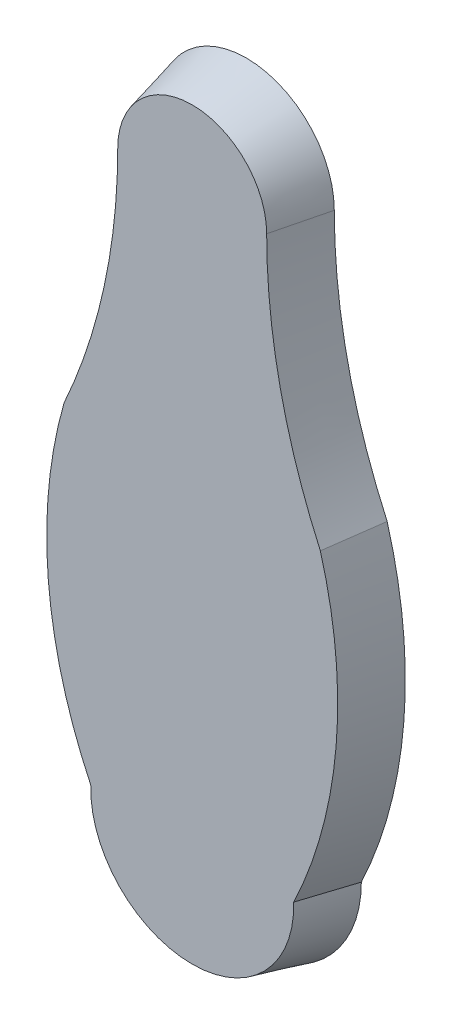
from build123d import *

# Parameters (mm, degrees)
BOSS_EXTRUDE1_DEPTH = 20
BOSS_EXTRUDE1_DRAFT = 14


with BuildPart() as part:
    # Sketch1 → Boss-Extrude1 (with draft: the straight prism first)
    with BuildSketch(Plane.XY):
        with BuildLine():
            ThreePointArc((-42.5, 0), (0, -42.5), (42.5, 0))
            ThreePointArc((42.5, 0), (58.212978051, 59.230104498), (52.040453066, 120.197332527))
            ThreePointArc((52.040453066, 120.197332527), (37.441607235, 164.047991362), (32.5, 210))
            ThreePointArc((32.5, 210), (0, 242.5), (-32.5, 210))
            ThreePointArc((-32.5, 210), (-37.441607235, 164.047991362), (-52.040453066, 120.197332527))
            ThreePointArc((-52.040453066, 120.197332527), (-58.212978051, 59.230104498), (-42.5, 0))
        make_face()
    extrude(amount=BOSS_EXTRUDE1_DEPTH)
    # Boss-Extrude1: the draft: its side faces are tilted about the plane it starts from
    boss_extrude1_sides = [part.faces().sort_by_distance(p)[0] for p in [
        (-58.212978051, 59.230104498, 10),
        (0, -42.5, 10),
        (58.212978051, 59.230104498, 10),
        (37.441607235, 164.047991362, 10),
        (0, 242.5, 10),
        (-37.441607235, 164.047991362, 10),
    ]]
    draft(boss_extrude1_sides, Plane.XY, BOSS_EXTRUDE1_DRAFT)


solid = part.part
